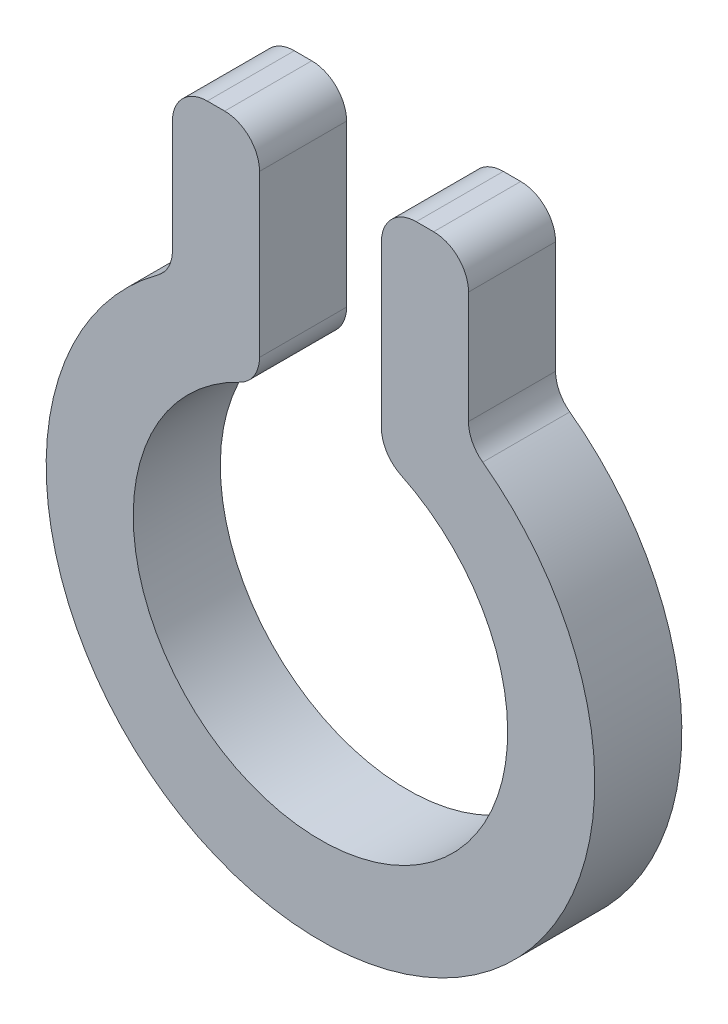
from build123d import *

# Parameters (mm, degrees)
BOSS_EXTRUDE1_DEPTH = 5
FILLET1_R           = 2


with BuildPart() as part:
    # Sketch1 → Boss-Extrude1 (new body)
    with BuildSketch(Plane.XY):
        with BuildLine():
            Line((3.5, 22.75), (8.5, 22.75))
            Line((8.5, 22.75), (8.5, 13.259430606))
            ThreePointArc((8.5, 13.259430606), (0, -15.75), (-8.5, 13.259430606))
            Line((-8.5, 13.259430606), (-8.5, 22.75))
            Line((-8.5, 22.75), (-3.5, 22.75))
            Line((-3.5, 22.75), (-3.5, 10.164275675))
            ThreePointArc((-3.5, 10.164275675), (0, -10.75), (3.5, 10.164275675))
            Line((3.5, 10.164275675), (3.5, 22.75))
        make_face()
    extrude(amount=BOSS_EXTRUDE1_DEPTH)

    # Fillet1
    fillet1_edges = [part.edges().sort_by_distance(p)[0] for p in [
        (-8.5, 13.259430606, 2.5),
        (-8.5, 22.75, 2.5),
        (-3.5, 22.75, 2.5),
        (-3.5, 10.164275675, 2.5),
        (3.5, 10.164275675, 2.5),
        (3.5, 22.75, 2.5),
        (8.5, 22.75, 2.5),
        (8.5, 13.259430606, 2.5),
    ]]
    fillet(fillet1_edges, radius=FILLET1_R)


solid = part.part
